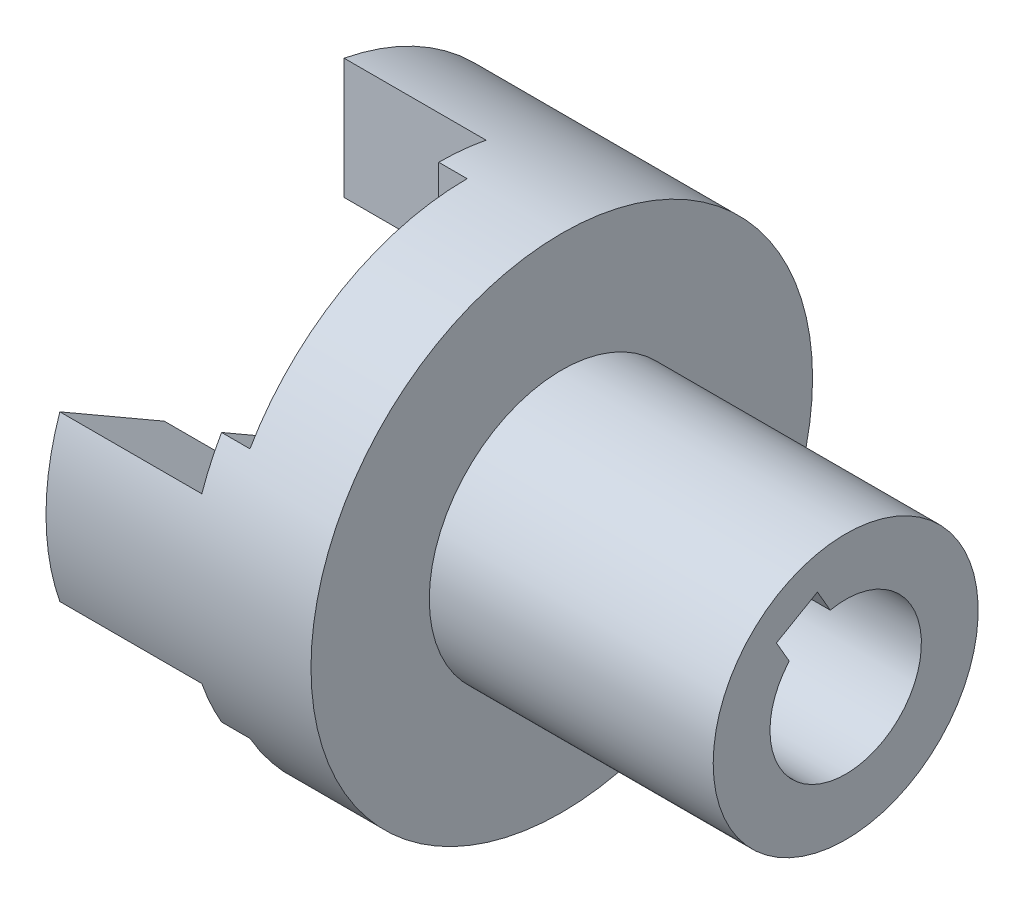
from build123d import *
from build123d.topology import SkipClean

# Parameters (mm, degrees)
EXTRUDE_1_DEPTH          = 3
EXTRUDE_2_DEPTH          = 15
PATTERN_CIRCULAR_1_COUNT = 3
CUT_EXTRUDE_1_DEPTH      = 70.054326439


with BuildPart() as part:
    # Эскиз1 → Повернуть1 (revolve)
    with BuildSketch(Plane.XY, mode=Mode.PRIVATE) as revolve_1_sk:
        Polygon((0, 8), (0, 26.5), (10, 26.5), (10, 14), (40, 14), (40, 8), align=None)
    revolve(revolve_1_sk.sketch.rotate(Axis((0, 0, 0), (1, 0, 0)), 90), axis=Axis((0, 0, 0), (1, 0, 0)))

    # Эскиз2 → Бобышка-Вытянуть1 (add)
    with BuildSketch(Plane.ZY):
        with BuildLine():
            Line((22.9496732, 13.25), (14, 8.082903769))
            Line((14, 8.082903769), (14, -8.082903769))
            Line((14, -8.082903769), (22.9496732, -13.25))
            ThreePointArc((22.9496732, -13.25), (26.5, 0), (22.9496732, 13.25))
        make_face()
    extrude_1 = extrude(amount=EXTRUDE_1_DEPTH)

    # Эскиз3 → Бобышка-Вытянуть2 (add)
    with BuildSketch(Plane.ZY.offset(3)):
        with BuildLine():
            Line((25.037468802, 8.681886661), (14, 2.309401077))
            Line((14, 2.309401077), (14, -2.309401077))
            Line((14, -2.309401077), (25.037468802, -8.681886661))
            ThreePointArc((25.037468802, -8.681886661), (26.5, 0), (25.037468802, 8.681886661))
        make_face()
    extrude_2 = extrude(amount=EXTRUDE_2_DEPTH)

    # Круговой массив1: Бобышка-Вытянуть1, Бобышка-Вытянуть2 ×3 about axis
    with SkipClean():  # the faces are left unmerged after this step: merging them gives an invalid solid
        pattern_circular_1_axis = Axis((0, 0, 0), (1, 0, 0))
        add([extrude_1.rotate(pattern_circular_1_axis, i * 360 / PATTERN_CIRCULAR_1_COUNT) for i in range(1, PATTERN_CIRCULAR_1_COUNT)])
        add([extrude_2.rotate(pattern_circular_1_axis, i * 360 / PATTERN_CIRCULAR_1_COUNT) for i in range(1, PATTERN_CIRCULAR_1_COUNT)])

    # Эскиз4 → Вырез-Вытянуть1 (cut, through all)
    with SkipClean():  # the faces are left unmerged after this step: merging them gives an invalid solid
        with BuildSketch(Plane(origin=(40, 0, 0), x_dir=(0, 0, -1), z_dir=(1, 0, 0))):
            Polygon((-7.315063509, 7.670061659), (-2.984936491, 10.170061659), (2.165063509, 1.25), (-2.165063509, -1.25), align=None)
        extrude(amount=-CUT_EXTRUDE_1_DEPTH, mode=Mode.SUBTRACT)


solid = part.part
